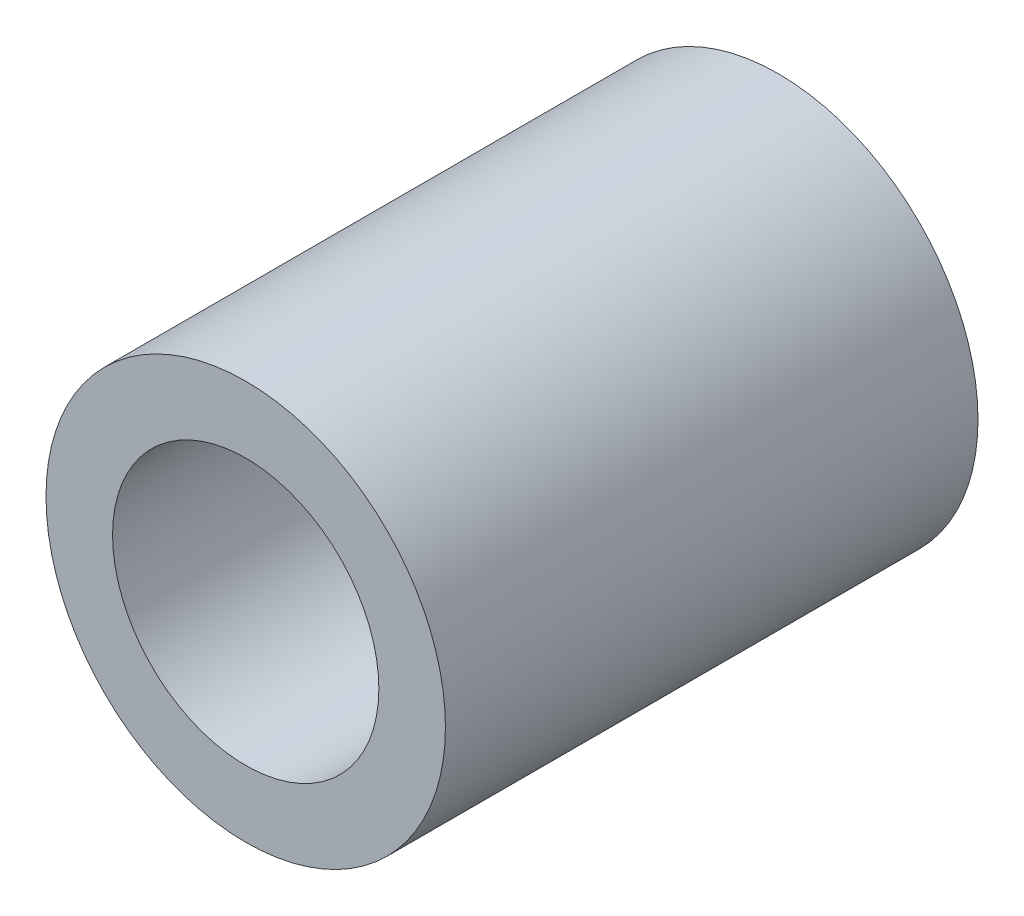
from build123d import *

# Parameters (mm, degrees)
SKETCH1_R           = 9.525
SKETCH1_R_2         = 6.35
BOSS_EXTRUDE1_DEPTH = 25.4


with BuildPart() as part:
    # Sketch1 → Boss-Extrude1 (new body)
    with BuildSketch(Plane.XY):
        Circle(SKETCH1_R)
        Circle(SKETCH1_R_2, mode=Mode.SUBTRACT)
    extrude(amount=-BOSS_EXTRUDE1_DEPTH)


solid = part.part
